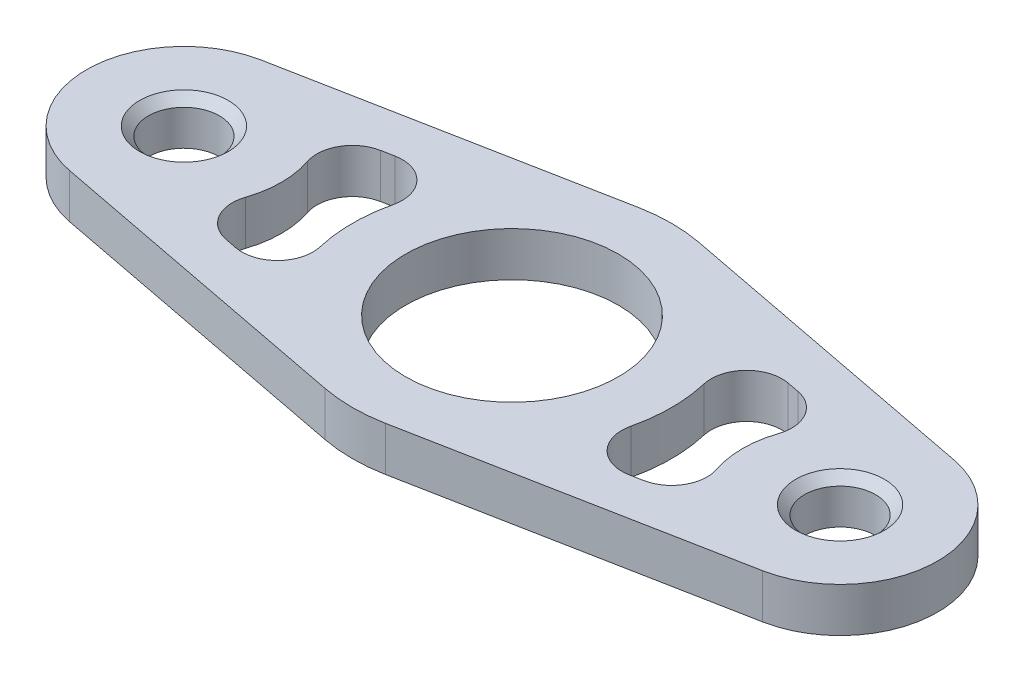
from build123d import *

# Parameters (mm, degrees)
SKETCH1_R           = 4
SKETCH1_R_2         = 12
BOSS_EXTRUDE1_DEPTH = 2.5
FILLET1_R           = 4
CHAMFER1_SIZE       = 1


with BuildPart() as part:
    # Sketch1 → Boss-Extrude1 (new, symmetric)
    with BuildSketch(Plane(origin=(0, 0, 0), x_dir=(1, 0, 0), z_dir=(0, 1, 0))):
        with BuildLine():
            Line((39.081081081, 10.801347209), (3.405405405, 17.674931797))
            ThreePointArc((3.405405405, 17.674931797), (0, 18), (-3.405405405, 17.674931797))
            Line((-3.405405405, 17.674931797), (-39.081081081, 10.801347209))
            ThreePointArc((-39.081081081, 10.801347209), (-48, 0), (-39.081081081, -10.801347209))
            Line((-39.081081081, -10.801347209), (-3.405405405, -17.674931797))
            ThreePointArc((-3.405405405, -17.674931797), (0, -18), (3.405405405, -17.674931797))
            Line((3.405405405, -17.674931797), (39.081081081, -10.801347209))
            ThreePointArc((39.081081081, -10.801347209), (48, 0), (39.081081081, 10.801347209))
        make_face()
        with Locations(Location((37, 0, 0), (0, 0, 270))):
            Circle(SKETCH1_R, mode=Mode.SUBTRACT)
        with Locations(Location((-37, 0, 0), (0, 0, 270))):
            Circle(SKETCH1_R, mode=Mode.SUBTRACT)
        with Locations(Location((0, 0, 0), (0, 0, 270))):
            Circle(SKETCH1_R_2, mode=Mode.SUBTRACT)
        with BuildLine():
            Line((-29.082089608, -7.635882073), (-14.68452203, -10.40984211))
            ThreePointArc((-14.68452203, -10.40984211), (-18, 0), (-14.68452203, 10.40984211))
            Line((-14.68452203, 10.40984211), (-29.082089608, 7.635882073))
            ThreePointArc((-29.082089608, 7.635882073), (-26, 0), (-29.082089608, -7.635882073))
        make_face(mode=Mode.SUBTRACT)
        with BuildLine():
            ThreePointArc((14.68452203, 10.40984211), (18, 0), (14.68452203, -10.40984211))
            Line((14.68452203, -10.40984211), (29.082089608, -7.635882073))
            ThreePointArc((29.082089608, -7.635882073), (26, 0), (29.082089608, 7.635882073))
            Line((29.082089608, 7.635882073), (14.68452203, 10.40984211))
        make_face(mode=Mode.SUBTRACT)
    extrude(amount=BOSS_EXTRUDE1_DEPTH, both=True)

    # Fillet1
    fillet1_edges = [part.edges().sort_by_distance(p)[0] for p in [
        (14.68452203, 0, 10.40984211),
        (29.082089608, 0, 7.635882073),
        (29.082089608, 0, -7.635882073),
        (14.68452203, 0, -10.40984211),
        (-14.68452203, 0, 10.40984211),
        (-14.68452203, 0, -10.40984211),
        (-29.082089608, 0, -7.635882073),
        (-29.082089608, 0, 7.635882073),
    ]]
    fillet(fillet1_edges, radius=FILLET1_R)

    # Chamfer1
    chamfer1_edges = [part.edges().sort_by_distance(p)[0] for p in [
        (37, 2.5, -4),
        (-37, 2.5, -4),
    ]]
    chamfer(chamfer1_edges, length=CHAMFER1_SIZE)


solid = part.part
